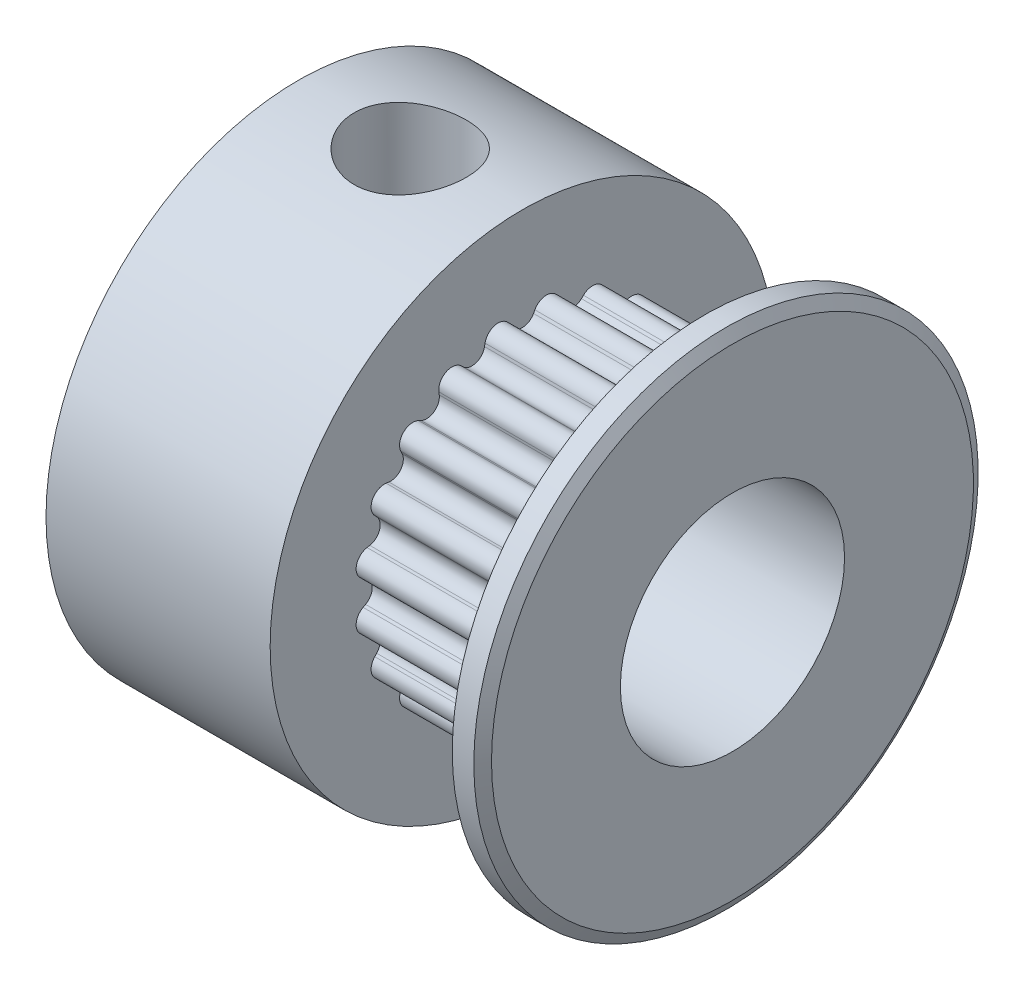
from build123d import *
from build123d.topology import SkipClean

# Parameters (mm, degrees)
CHAMFER1_SIZE       = 0.4
CHAMFER1_SIZE2      = 0.230940108
SKETCH2_R           = 2.5
CUT_EXTRUDE1_DEPTH  = 16.305227865
SKETCH3_R           = 4
SKETCH3_R_2         = 3.25
CUT_EXTRUDE2_DEPTH  = 0.5
CUT_EXTRUDE3_START  = -0.5
SKETCH4_R           = 4
SKETCH4_R_2         = 3.25
CUT_EXTRUDE3_DEPTH  = 0.5
CUT_EXTRUDE4_START  = -1
CUT_EXTRUDE4_DEPTH  = 6.5
CIRPATTERN1_COUNT   = 20
SKETCH6_R           = 9
SKETCH6_R_2         = 4
BOSS_EXTRUDE1_DEPTH = 7
CUT_EXTRUDE6_START  = -16
SKETCH7_R           = 4
CUT_EXTRUDE6_DEPTH  = 16
SKETCH8_R           = 2
CUT_EXTRUDE7_DEPTH  = 16
CIRPATTERN2_COUNT   = 2
CIRPATTERN2_ANGLE   = 90


with BuildPart() as part:
    # Sketch1 → Revolve1 (revolve)
    with BuildSketch(Plane.XY):
        Polygon((0, 0), (0, 9), (1, 9), (1, 6), (7.5, 6), (7.5, 9), (8.5, 9), (8.5, 0), align=None)
    revolve(axis=Axis((0, 0, 0), (1, 0, 0)))

    # Chamfer1
    chamfer1_edges = [part.edges().sort_by_distance(p)[0] for p in [
        (8.5, -9, 0),
    ]]
    chamfer1_side = [part.faces().sort_by_distance(p)[0] for p in [
        (8.5, 0, 0),
    ]]
    chamfer(chamfer1_edges, length=CHAMFER1_SIZE, length2=CHAMFER1_SIZE2, reference=chamfer1_side[0])

    # Sketch2 → Cut-Extrude1 (cut, through all)
    with BuildSketch(Plane(origin=(8.5, 0, 0), x_dir=(0, 0, -1), z_dir=(1, 0, 0))):
        Circle(SKETCH2_R)
    extrude(amount=-CUT_EXTRUDE1_DEPTH, mode=Mode.SUBTRACT)

    # Sketch3 → Cut-Extrude2 (cut)
    with BuildSketch(Plane(origin=(8.5, 0, 0), x_dir=(0, 0, -1), z_dir=(1, 0, 0))):
        Circle(SKETCH3_R)
        Circle(SKETCH3_R_2, mode=Mode.SUBTRACT)
    extrude(amount=-CUT_EXTRUDE2_DEPTH, mode=Mode.SUBTRACT)

    # Sketch4 → Cut-Extrude3 (cut)
    with BuildSketch(Plane.ZY.offset(CUT_EXTRUDE3_START)):
        Circle(SKETCH4_R)
        Circle(SKETCH4_R_2, mode=Mode.SUBTRACT)
    extrude(amount=CUT_EXTRUDE3_DEPTH, mode=Mode.SUBTRACT)

    # Sketch5 → Cut-Extrude4 (cut)
    with BuildSketch(Plane(origin=(8.5, 0, 0), x_dir=(0, 0, -1), z_dir=(1, 0, 0)).offset(CUT_EXTRUDE4_START)):
        with BuildLine():
            Line((-0.399467443, 5.594643379), (-0.447274199, 5.683157544))
            ThreePointArc((-0.447274199, 5.683157544), (-0.654270663, 5.882840909), (-0.93860679, 5.926130044))
            ThreePointArc((-0.93860679, 5.926130044), (0, 6), (0.93860679, 5.926130044))
            ThreePointArc((0.93860679, 5.926130044), (0.654270663, 5.882840909), (0.447274199, 5.683157544))
            Line((0.447274199, 5.683157544), (0.399467443, 5.594643379))
            ThreePointArc((0.399467443, 5.594643379), (0, 5.356388285), (-0.399467443, 5.594643379))
        make_face()
    cut_extrude4 = extrude(amount=-CUT_EXTRUDE4_DEPTH, mode=Mode.SUBTRACT)

    # CirPattern1: Cut-Extrude4 ×20 about axis
    cirpattern1_axis = Axis((0, 0, 0), (1, 0, 0))
    for i in range(1, CIRPATTERN1_COUNT):
        add(cut_extrude4.rotate(cirpattern1_axis, i * 360 / CIRPATTERN1_COUNT), mode=Mode.SUBTRACT)

    # Sketch6 → Boss-Extrude1 (add)
    with BuildSketch(Plane.ZY):
        Circle(SKETCH6_R)
        Circle(SKETCH6_R_2, mode=Mode.SUBTRACT)
    extrude(amount=BOSS_EXTRUDE1_DEPTH)

    # Sketch7 → Cut-Extrude6 (cut)
    with SkipClean():  # the faces are left unmerged after this step: merging them gives an invalid solid
        with BuildSketch(Plane.ZY.offset(7).offset(CUT_EXTRUDE6_START)):
            Circle(SKETCH7_R)
        extrude(amount=CUT_EXTRUDE6_DEPTH, mode=Mode.SUBTRACT)

    # Sketch8 → Cut-Extrude7 (cut)
    with SkipClean():  # the faces are left unmerged after this step: merging them gives an invalid solid
        with BuildSketch(Plane.XY):
            with Locations((-3, 0)):
                Circle(SKETCH8_R)
        cut_extrude7 = extrude(amount=-CUT_EXTRUDE7_DEPTH, mode=Mode.SUBTRACT)

    # CirPattern2: Cut-Extrude7 ×2 about axis
    with SkipClean():  # the faces are left unmerged after this step: merging them gives an invalid solid
        cirpattern2_axis = Axis((0, 0, 0), (1, 0, 0))
        for i in range(1, CIRPATTERN2_COUNT):
            add(cut_extrude7.rotate(cirpattern2_axis, i * CIRPATTERN2_ANGLE / (CIRPATTERN2_COUNT - 1)), mode=Mode.SUBTRACT)


solid = part.part
